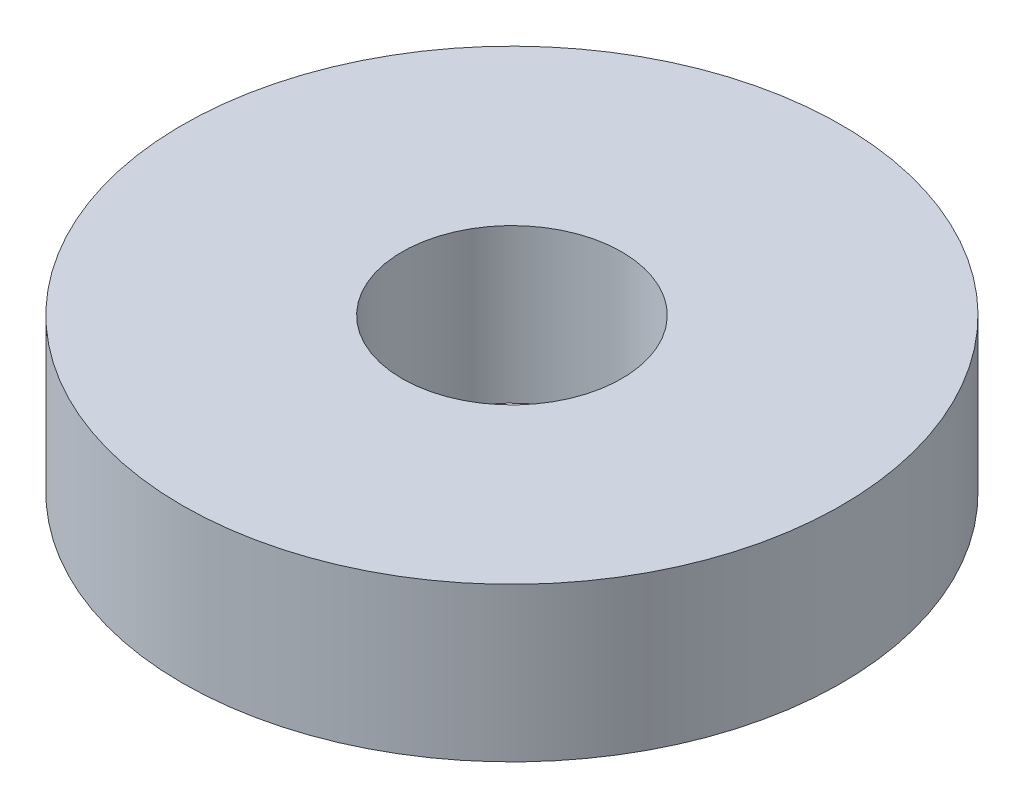
from build123d import *

# Parameters (mm, degrees)
SKETCH_1_R      = 7.5
SKETCH_1_R_2    = 2.5
EXTRUDE_1_DEPTH = 3.5


with BuildPart() as part:
    # 草图1 → 凸台-拉伸1 (new body)
    with BuildSketch(Plane(origin=(0, 0, 0), x_dir=(1, 0, 0), z_dir=(0, 1, 0))):
        with Locations(Location((0, 0, 0), (0, 0, 270))):
            Circle(SKETCH_1_R)
        with Locations(Location((0, 0, 0), (0, 0, 270))):
            Circle(SKETCH_1_R_2, mode=Mode.SUBTRACT)
    extrude(amount=EXTRUDE_1_DEPTH)


solid = part.part
